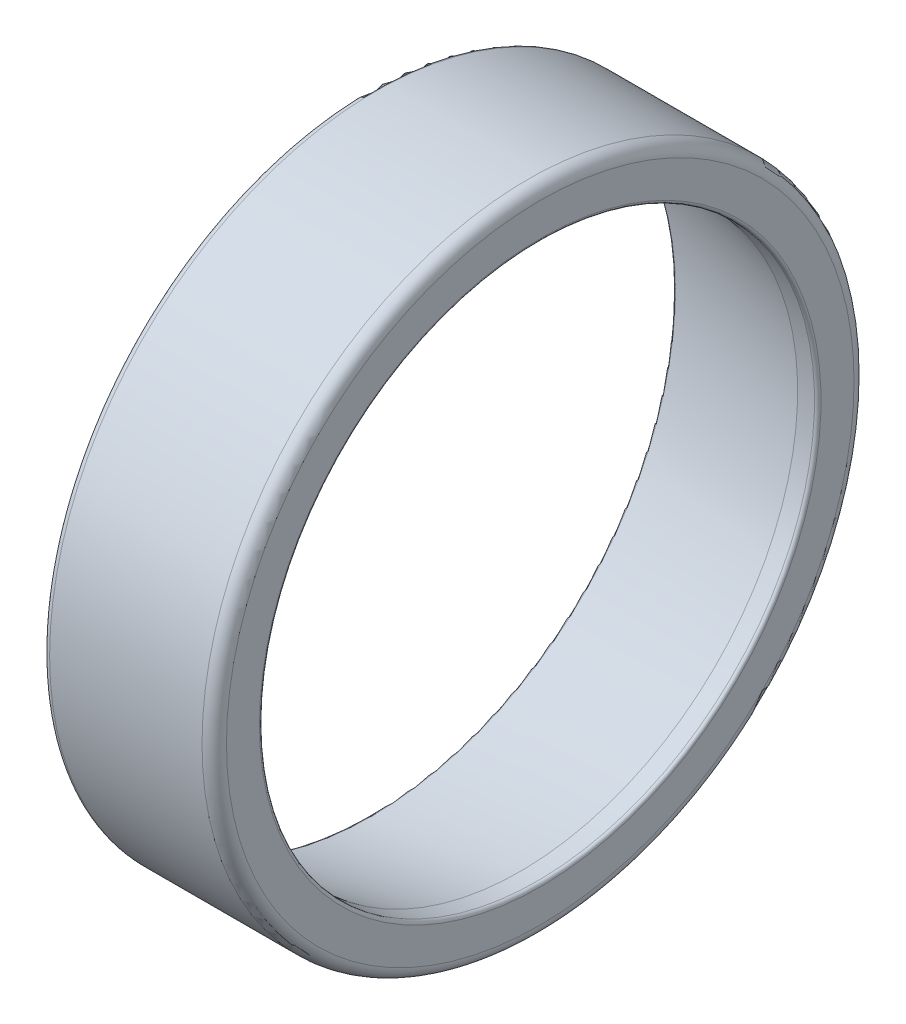
from build123d import *

# Parameters (mm, degrees)
FILLET1_R = 1.5
FILLET2_R = 0.8
FILLET3_R = 0.4


with BuildPart() as part:
    # Sketch1 → Revolve1 (revolve)
    with BuildSketch(Plane.XY, mode=Mode.PRIVATE) as revolve1_sk:
        Polygon((22, 34.05), (22, 40), (1, 40), (1, 37.317672581), (19.5318921, 34.05), align=None)
    revolve(revolve1_sk.sketch.rotate(Axis((0, 0, 0), (1, 0, 0)), 90), axis=Axis((0, 0, 0), (1, 0, 0)))

    # Fillet1
    fillet1_edges = [part.edges().sort_by_distance(p)[0] for p in [
        (22, 0, -40),
    ]]
    fillet(fillet1_edges, radius=FILLET1_R)

    # Fillet2
    fillet2_edges = [part.edges().sort_by_distance(p)[0] for p in [
        (1, 0, -40),
    ]]
    fillet(fillet2_edges, radius=FILLET2_R)

    # Fillet3
    fillet3_edges = [part.edges().sort_by_distance(p)[0] for p in [
        (22, 0, -34.05),
        (1, 0, -37.317672581),
    ]]
    fillet(fillet3_edges, radius=FILLET3_R)


solid = part.part
